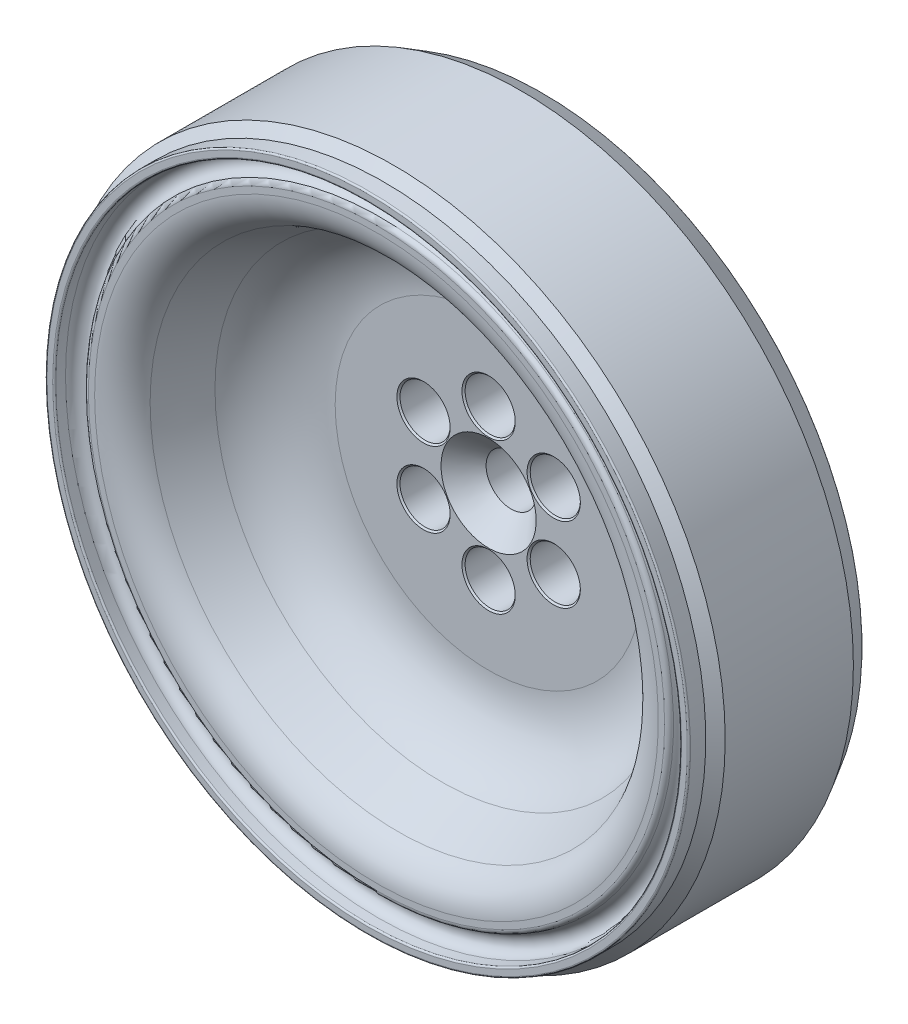
from build123d import *

# Parameters (mm, degrees)
CIRPATTERN1_COUNT = 6
CIRPATTERN2_COUNT = 2
FILLET1_R         = 0.25


with BuildPart() as part:
    # Sketch1 → Revolve1 (revolve)
    with BuildSketch(Plane(origin=(0, 0, 0), x_dir=(0, 0, -1), z_dir=(1, 0, 0)), mode=Mode.PRIVATE) as revolve1_sk:
        with BuildLine():
            Line((0, 4.75), (0, 18.98))
            Line((0, 18.98), (-1, 19.98))
            Line((-1, 19.98), (-7.7, 19.98))
            ThreePointArc((-7.7, 19.98), (-8.265685425, 20.214314575), (-8.5, 20.78))
            Line((-8.5, 20.78), (-8.5, 28))
            Line((-8.5, 28), (-8.8, 28))
            Line((-8.8, 28), (-8.8, 37))
            Line((-8.8, 37), (-8.5, 37))
            Line((-8.5, 37), (-8.5, 51))
            Line((-8.5, 51), (-11.834197805, 52.925))
            Line((-11.834197805, 52.925), (-32.3, 52.925))
            Line((-32.3, 52.925), (-33.85, 51.375))
            Line((-33.85, 51.375), (-36.3, 51.375))
            ThreePointArc((-36.3, 51.375), (-36.476776695, 51.301776695), (-36.55, 51.125))
            Line((-36.55, 51.125), (-36.55, 50.2))
            ThreePointArc((-36.55, 50.2), (-36.476776695, 50.023223305), (-36.3, 49.95))
            Line((-36.3, 49.95), (-34.75, 49.95))
            ThreePointArc((-34.75, 49.95), (-33.158801053, 48.517588514), (-34.416666667, 46.785107387))
            ThreePointArc((-34.416666667, 46.785107387), (-34.87182527, 46.505983377), (-35.05, 46.002661081))
            Line((-35.05, 46.002661081), (-35.05, 45))
            ThreePointArc((-35.05, 45), (-34.119553122, 41.790696159), (-31.61678962, 39.576754565))
            Line((-31.61678962, 39.576754565), (-24.588622491, 36.250365109))
            ThreePointArc((-24.588622491, 36.250365109), (-19.165968235, 31.453491655), (-17.15, 24.5))
            Line((-17.15, 24.5), (-17.15, 7.6))
            Line((-17.15, 7.6), (-13.55, 4))
            Line((-13.55, 4), (-0.75, 4))
            Line((-0.75, 4), (0, 4.75))
        make_face()
    revolve(revolve1_sk.sketch.rotate(Axis((0, 0, 0), (0, 0, 1)), 90), axis=Axis((0, 0, 0), (0, 0, 1)))

    # Sketch3 → M8.0 (8) Diameter Hole1 (revolve, cut)
    with BuildSketch(Plane(origin=(0, 12, 0), x_dir=(0, 1, 0), z_dir=(1, 0, 0))):
        Polygon((0, 0), (0, 17.15), (4.25, 17.15), (4, 16.9), (4, 0.5), (4.5, 0), align=None)
    m8_0_8_diameter_hole1 = revolve(axis=Axis((0, 12, -6.35), (0, 0, 1)), mode=Mode.SUBTRACT)

    # CirPattern1: M8.0 (8) Diameter Hole1 ×6 about axis
    cirpattern1_axis = Axis((0, 0, 0), (0, 0, 1))
    for i in range(1, CIRPATTERN1_COUNT):
        add(m8_0_8_diameter_hole1.rotate(cirpattern1_axis, i * 360 / CIRPATTERN1_COUNT), mode=Mode.SUBTRACT)

    # Sketch5 → M8.0 (8) Diameter Hole2 (revolve, cut)
    with BuildSketch(Plane(origin=(0, 45, 8.5), x_dir=(0, 1, 0), z_dir=(1, 0, 0))):
        Polygon((0, 0), (0, 14.803442476), (4, 12.4), (4, 0.5), (4.5, 0), align=None)
    m8_0_8_diameter_hole2 = revolve(axis=Axis((0, 45, 2.15), (0, 0, 1)), mode=Mode.SUBTRACT)

    # CirPattern2: M8.0 (8) Diameter Hole2 ×2 about axis
    cirpattern2_axis = Axis((0, 0, 0), (0, 0, 1))
    for i in range(1, CIRPATTERN2_COUNT):
        add(m8_0_8_diameter_hole2.rotate(cirpattern2_axis, i * 360 / CIRPATTERN2_COUNT), mode=Mode.SUBTRACT)

    # Fillet1
    fillet1_edges = [part.edges().sort_by_distance(p)[0] for p in [
        (51, 0, 8.5),
    ]]
    fillet(fillet1_edges, radius=FILLET1_R)


solid = part.part
